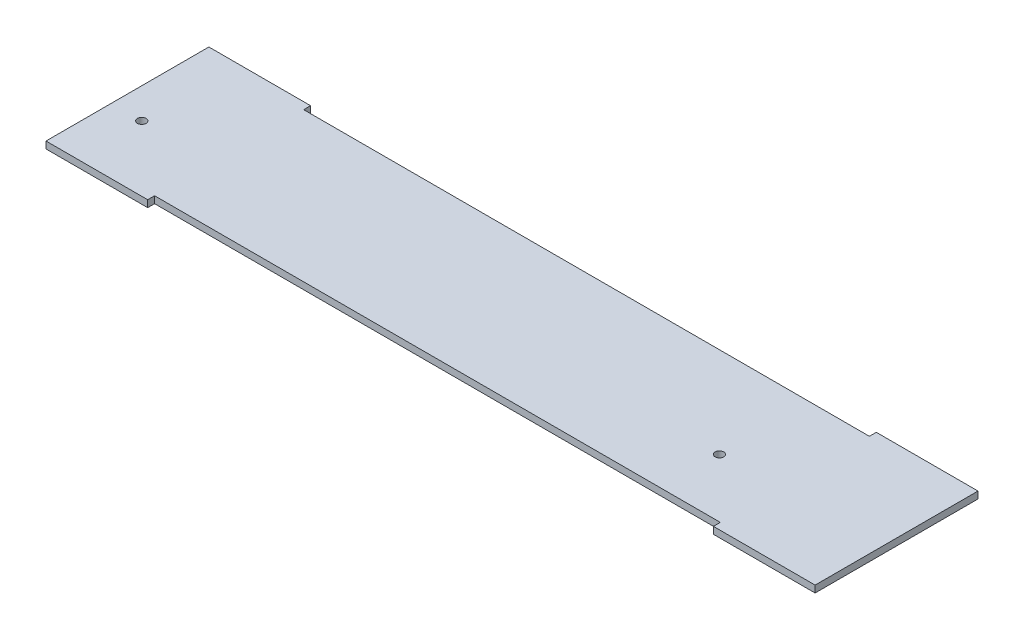
from build123d import *

# Parameters (mm, degrees)
BOSS_EXTRUDE1_DEPTH  = 3.175
SKETCH4_R            = 4
LEFT_AND_RIGHT_DEPTH = 363.060140032


with BuildPart() as part:
    # Sketch1 → Boss-Extrude1 (new, symmetric)
    with BuildSketch(Plane(origin=(0, 0, 0), x_dir=(1, 0, 0), z_dir=(0, 1, 0))):
        Polygon((-354.15, 75), (-354.15, -75), (-260.5, -75), (-260.5, -68.65), (260.5, -68.65), (260.5, -75), (354.15, -75), (354.15, 75), (260.5, 75), (260.5, 68.65), (-260.5, 68.65), (-260.5, 75), align=None)
    extrude(amount=BOSS_EXTRUDE1_DEPTH, both=True)

    # Sketch4 → Left and Right (cut, through all)
    with BuildSketch(Plane.XZ.offset(3.175)):
        with Locations(Location((-326.1, 14.85, 0), (0, 0, 270))):
            Circle(SKETCH4_R)
        with Locations(Location((205.9, 14.85, 0), (0, 0, 270))):
            Circle(SKETCH4_R)
    extrude(amount=-LEFT_AND_RIGHT_DEPTH, mode=Mode.SUBTRACT)


solid = part.part
